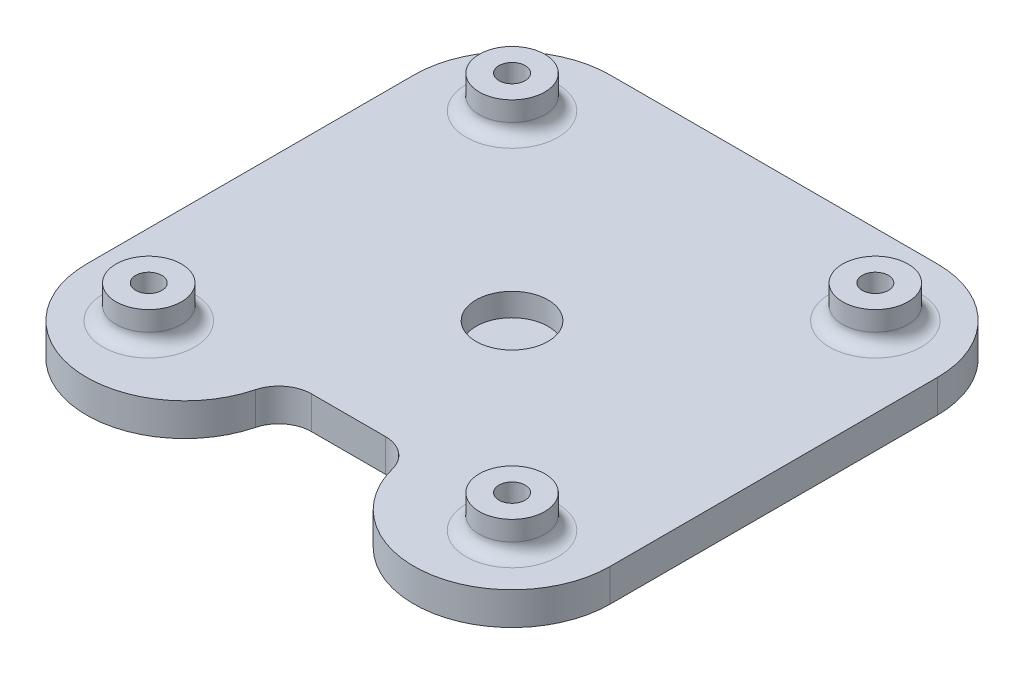
from build123d import *

# Parameters (mm, degrees)
BOSS_EXTRUDE6_DEPTH = 10
FILLET4_R           = 10
SKETCH13_R          = 4
CUT_EXTRUDE5_DEPTH  = 114.578166916
SKETCH14_R          = 10
BOSS_EXTRUDE7_DEPTH = 10
SKETCH15_R          = 4
CUT_EXTRUDE6_DEPTH  = 114.578166916
FILLET5_R           = 4
SKETCH16_R          = 11
CUT_EXTRUDE7_DEPTH  = 7


with BuildPart() as part:
    # Sketch12 → Boss-Extrude6 (new body)
    with BuildSketch(Plane(origin=(0, 0, 0), x_dir=(1, 0, 0), z_dir=(0, 1, 0))):
        with BuildLine():
            Line((-20, -50), (20, -50))
            ThreePointArc((20, -50), (28.786796564, -71.213203436), (50, -80))
            ThreePointArc((50, -80), (71.213203436, -71.213203436), (80, -50))
            Line((80, -50), (80, 50))
            ThreePointArc((80, 50), (71.213203436, 71.213203436), (50, 80))
            Line((50, 80), (-50, 80))
            ThreePointArc((-50, 80), (-71.213203436, 71.213203436), (-80, 50))
            Line((-80, 50), (-80, -50))
            ThreePointArc((-80, -50), (-71.213203436, -71.213203436), (-50, -80))
            ThreePointArc((-50, -80), (-28.786796564, -71.213203436), (-20, -50))
        make_face()
    extrude(amount=BOSS_EXTRUDE6_DEPTH)

    # Fillet4
    fillet4_edges = [part.edges().sort_by_distance(p)[0] for p in [
        (20, 5, 50),
        (-20, 5, 50),
    ]]
    fillet(fillet4_edges, radius=FILLET4_R)

    # Sketch13 → Cut-Extrude5 (cut, through all)
    with BuildSketch(Plane(origin=(0, 10, 0), x_dir=(1, 0, 0), z_dir=(0, 1, 0))):
        with Locations(Location((-55.5, 55.5, 0), (0, 0, 270))):
            Circle(SKETCH13_R)
        with Locations(Location((55.5, 55.5, 0), (0, 0, 270))):
            Circle(SKETCH13_R)
        with Locations(Location((-55.5, -55.5, 0), (0, 0, 270))):
            Circle(SKETCH13_R)
        with Locations(Location((55.5, -55.5, 0), (0, 0, 270))):
            Circle(SKETCH13_R)
    extrude(amount=-CUT_EXTRUDE5_DEPTH, mode=Mode.SUBTRACT)

    # Sketch14 → Boss-Extrude7 (add)
    with BuildSketch(Plane(origin=(0, 10, 0), x_dir=(1, 0, 0), z_dir=(0, 1, 0))):
        with Locations(Location((-55.5, 55.5, 0), (0, 0, 90))):
            Circle(SKETCH14_R)
        with Locations(Location((55.5, 55.5, 0), (0, 0, 90))):
            Circle(SKETCH14_R)
        with Locations(Location((-55.5, -55.5, 0), (0, 0, 90))):
            Circle(SKETCH14_R)
        with Locations(Location((55.5, -55.5, 0), (0, 0, 90))):
            Circle(SKETCH14_R)
    extrude(amount=BOSS_EXTRUDE7_DEPTH)

    # Sketch15 → Cut-Extrude6 (cut, through all)
    with BuildSketch(Plane.XZ.offset(-10)):
        with Locations(Location((-55.5, -55.5, 0), (0, 0, 90))):
            Circle(SKETCH15_R)
        with Locations(Location((-55.5, 55.5, 0), (0, 0, 90))):
            Circle(SKETCH15_R)
        with Locations(Location((55.5, 55.5, 0), (0, 0, 90))):
            Circle(SKETCH15_R)
        with Locations(Location((55.5, -55.5, 0), (0, 0, 90))):
            Circle(SKETCH15_R)
    extrude(amount=-CUT_EXTRUDE6_DEPTH, mode=Mode.SUBTRACT)

    # Fillet5
    fillet5_edges = [part.edges().sort_by_distance(p)[0] for p in [
        (-55.5, 10, -45.5),
        (-55.5, 10, 65.5),
        (55.5, 10, 65.5),
        (55.5, 10, -45.5),
    ]]
    fillet(fillet5_edges, radius=FILLET5_R)

    # Sketch16 → Cut-Extrude7 (cut)
    with BuildSketch(Plane(origin=(0, 10, 0), x_dir=(1, 0, 0), z_dir=(0, 1, 0))):
        with Locations(Location((0, 0, 0), (0, 0, 270))):
            Circle(SKETCH16_R)
    extrude(amount=-CUT_EXTRUDE7_DEPTH, mode=Mode.SUBTRACT)


solid = part.part
